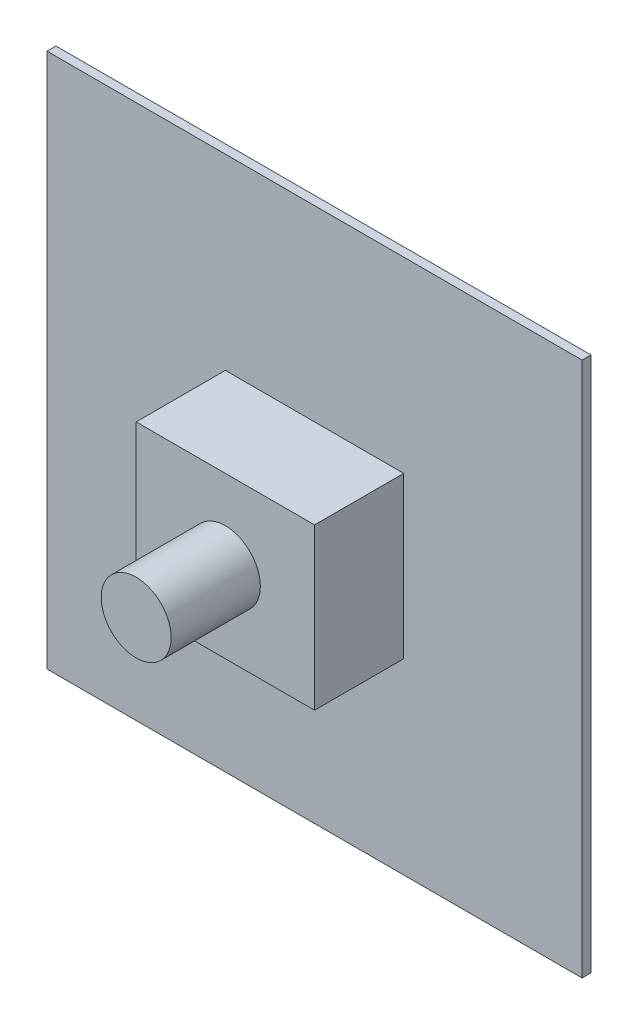
from build123d import *

# Parameters (mm, degrees)
SKETCH_1_W      = 3000
SKETCH_1_H      = 3000
EXTRUDE_1_DEPTH = 50
SKETCH_2_W      = 1000
SKETCH_2_H      = 900
EXTRUDE_2_DEPTH = 500
SKETCH_3_R      = 196.131085291
EXTRUDE_3_DEPTH = 500


with BuildPart() as part:
    # 草圖1 → 填料-伸長1 (new body)
    with BuildSketch(Plane.XY):
        Rectangle(SKETCH_1_W, SKETCH_1_H)
    extrude(amount=EXTRUDE_1_DEPTH)

    # 草圖2 → 填料-伸長2 (add)
    with BuildSketch(Plane.XY.offset(50)):
        Rectangle(SKETCH_2_W, SKETCH_2_H)
    extrude(amount=EXTRUDE_2_DEPTH)

    # 草圖3 → 填料-伸長3 (add)
    with BuildSketch(Plane.XY.offset(550)):
        Circle(SKETCH_3_R)
    extrude(amount=EXTRUDE_3_DEPTH)


solid = part.part
